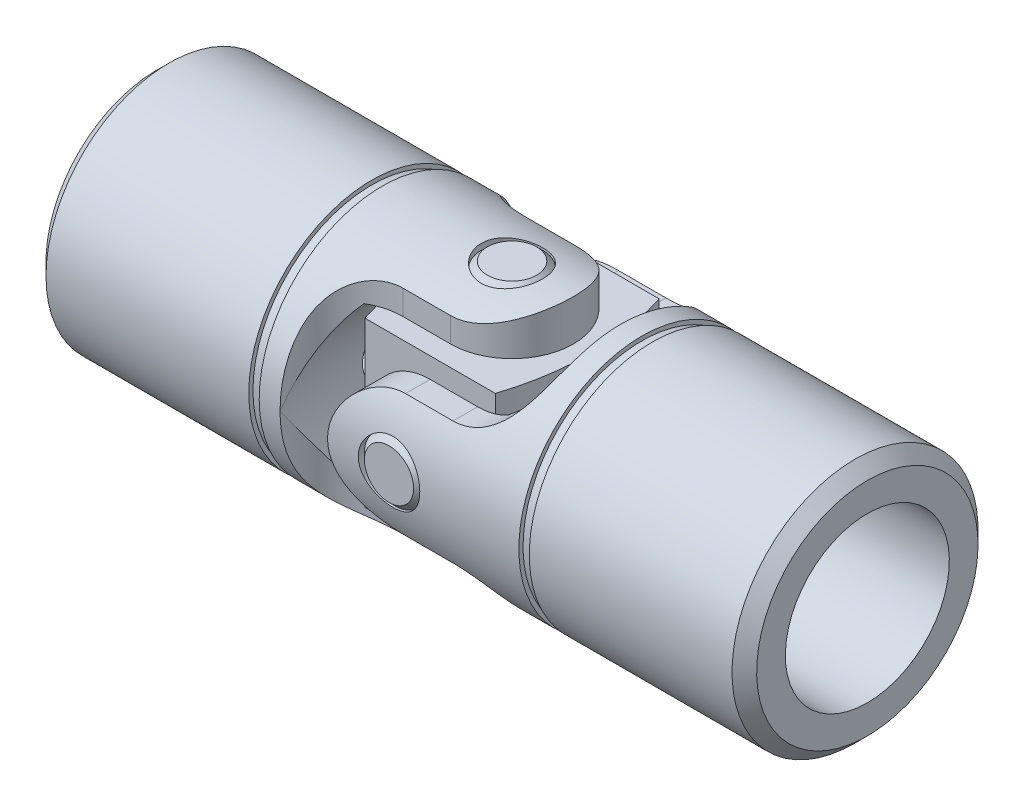
from build123d import *

# Parameters (mm, degrees)
CHAMFER1_SIZE               = 1.42875
EXTRUDE1_DEPTH              = 46.955314573
EXTRUDE1_DEPTH_BACK         = 46.955314573
EXTRUDE3_DEPTH              = 46.955314635
EXTRUDE3_DEPTH_BACK         = 46.955314635
SKETCH4_R                   = 9.525
EXTRUDE4_DEPTH              = 23.8125
EXTRUDE6_DEPTH              = 46.955314635
EXTRUDE6_DEPTH_BACK         = 46.955314635
SKETCH6_R                   = 3.571875
BODY_MOVE_COPY1_ANGLE       = 90
EXTRUDE10_REACH             = 47.955
SKETCH10_W                  = 18.176875
SKETCH10_H                  = 19.03095
EXTRUDE10_DIRECTION_2_REACH = 47.955
CUT_EXTRUDE2_DEPTH          = 50.742737236
EXTRUDE13_DEPTH             = 46.955314635
EXTRUDE13_DEPTH_BACK        = 46.955314635
SKETCH13_R                  = 3.571875
SKETCH14_R                  = 3.571875
EXTRUDE14_DEPTH             = 14.2875
EXTRUDE15_DEPTH             = 46.955314635
EXTRUDE15_DEPTH_BACK        = 46.955314635
SKETCH15_R                  = 3.571875
SKETCH16_R                  = 3.571875
EXTRUDE16_DEPTH             = 14.2875
CHAMFER3_SIZE               = 0.714375


with BuildPart() as part:
    # Sketch1 → Revolve1 (revolve)
    with BuildSketch(Plane(origin=(0, 0, 0), x_dir=(1, 0, 0), z_dir=(0, 1, 0)), mode=Mode.PRIVATE) as revolve1_sk:
        Polygon((-41.275, 14.2875), (-16.29171875, 14.2875), (-16.29171875, 13.8033125), (-15.08125, 13.8033125), (-15.08125, 14.2875), (7.14375, 14.2875), (7.14375, 0), (-41.275, 0), align=None)
    revolve(revolve1_sk.sketch.rotate(Axis((-41.275, 0, 0), (1, 0, 0)), 180), axis=Axis((-41.275, 0, 0), (1, 0, 0)))

    # Chamfer1
    chamfer1_edges = [part.edges().sort_by_distance(p)[0] for p in [
        (-41.275, 0, -14.2875),
    ]]
    chamfer(chamfer1_edges, length=CHAMFER1_SIZE)

    # Sketch2 → Extrude1 (cut, two sides: drawn at the far end of the back side and taken through both)
    with BuildSketch(Plane(origin=(0, 0, 0), x_dir=(1, 0, 0), z_dir=(0, 1, 0)).offset(-EXTRUDE1_DEPTH_BACK)):
        with BuildLine():
            Line((-12.6603125, 14.2875), (14.2875, 14.2875))
            Line((14.2875, 14.2875), (14.2875, -14.2875))
            Line((14.2875, -14.2875), (-12.6603125, -14.2875))
            ThreePointArc((-12.6603125, -14.2875), (-10.567956568, -9.236105932), (-5.5165625, -7.14375))
            Line((-5.5165625, -7.14375), (0, -7.14375))
            ThreePointArc((0, -7.14375), (7.14375, 0), (0, 7.14375))
            Line((0, 7.14375), (-5.5165625, 7.14375))
            ThreePointArc((-5.5165625, 7.14375), (-10.567956568, 9.236105932), (-12.6603125, 14.2875))
        make_face()
    extrude(amount=EXTRUDE1_DEPTH + EXTRUDE1_DEPTH_BACK, mode=Mode.SUBTRACT)

    # Sketch3 → Extrude3 (cut, two sides: drawn at the far end of the back side and taken through both)
    with BuildSketch(Plane.XY.offset(-EXTRUDE3_DEPTH_BACK)):
        with BuildLine():
            Line((-9.0884375, 9.515475), (14.2875, 9.515475))
            Line((14.2875, 9.515475), (14.2875, -9.515475))
            Line((14.2875, -9.515475), (-9.0884375, -9.515475))
            ThreePointArc((-9.0884375, -9.515475), (-12.6603125, 0), (-9.0884375, 9.515475))
        make_face()
    extrude(amount=EXTRUDE3_DEPTH + EXTRUDE3_DEPTH_BACK, mode=Mode.SUBTRACT)

    # Sketch4 → Extrude4 (cut)
    with BuildSketch(Plane.ZY.offset(41.275)):
        Circle(SKETCH4_R)
    extrude(amount=-EXTRUDE4_DEPTH, mode=Mode.SUBTRACT)

    # Extrude5 cone 1 section (through the dimple's axis) → Extrude5 (revolve, cut)
    with BuildSketch(Plane(origin=(-17.4625, 0, 0), x_dir=(0, 0, 1), z_dir=(0, 1, 0))):
        Polygon((0, 0), (9.525, 0), (0, 9.525), align=None)
    revolve(axis=Axis((-17.4625, 0, 0), (1, 0, 0)), mode=Mode.SUBTRACT)

    # Sketch6 → Extrude6 (cut, two sides: drawn at the far end of the back side and taken through both)
    with BuildSketch(Plane(origin=(0, 0, 0), x_dir=(1, 0, 0), z_dir=(0, 1, 0)).offset(-EXTRUDE6_DEPTH_BACK)):
        with Locations(Location((0, 0, 0), (0, 0, 270))):
            Circle(SKETCH6_R)
    extrude(amount=EXTRUDE6_DEPTH + EXTRUDE6_DEPTH_BACK, mode=Mode.SUBTRACT)


with BuildPart() as body_2:
    # Mirror1: mirrored copy
    add(part.part.mirror(Plane(origin=(0, 0, 0), x_dir=(0, 0, 1), z_dir=(1, 0, 0))))


with BuildPart() as body_2_1:
    # Body-Move/Copy1: moved
    add(body_2.part.rotate(Axis((0, 0, 0), (1, 0, 0)), BODY_MOVE_COPY1_ANGLE))


with BuildPart() as body_3:

    # Extrude10: up to this face of the body (flat: up to its plane)
    extrude10_end = Plane(body_2_1.part.faces().sort_by_distance((7.424859144, -7.165639968, -9.515475))[0])
    # Sketch10 → Extrude10 (new, up to the picked face)
    with BuildSketch(Plane.XY, mode=Mode.PRIVATE) as extrude10_sk1:
        Rectangle(SKETCH10_W, SKETCH10_H)
    extrude10_tool1 = split(extrude(extrude10_sk1.sketch, amount=-EXTRUDE10_REACH, mode=Mode.PRIVATE), bisect_by=extrude10_end, keep=Keep.BOTH, mode=Mode.PRIVATE)
    add(extrude10_tool1.solids().sort_by(Axis((0, 0, 0), (0, 0, -1)))[0])


    # Extrude10 direction 2: up to this face of the body (flat: up to its plane)
    extrude10_direction_2_end = Plane(body_2_1.part.faces().sort_by_distance((8.859095449, 0, 9.515475))[0])
    # Sketch10 → Extrude10 direction 2 (add, up to the picked face)
    with BuildSketch(Plane.XY, mode=Mode.PRIVATE) as extrude10_direction_2_sk1:
        Rectangle(SKETCH10_W, SKETCH10_H)
    extrude10_direction_2_tool1 = split(extrude(extrude10_direction_2_sk1.sketch, amount=EXTRUDE10_DIRECTION_2_REACH, mode=Mode.PRIVATE), bisect_by=extrude10_direction_2_end, keep=Keep.BOTH, mode=Mode.PRIVATE)
    add(extrude10_direction_2_tool1.solids().sort_by(Axis((0, 0, 0), (0, 0, 1)))[0])

    # Sketch20 → Cut-Extrude2 (cut, through all)
    with BuildSketch(Plane(origin=(0, 9.515475, 0), x_dir=(1, 0, 0), z_dir=(0, 1, 0))):
        with BuildLine():
            Line((10.1044375, -10.531475), (10.1044375, 10.531475))
            Line((10.1044375, 10.531475), (7.573697917, 10.531475))
            Line((7.573697917, 10.531475), (7.573697917, 9.515475))
            ThreePointArc((7.573697917, 9.515475), (9.0884375, 0), (7.573697917, -9.515475))
            Line((7.573697917, -9.515475), (7.573697917, -10.531475))
            Line((7.573697917, -10.531475), (10.1044375, -10.531475))
        make_face()
        with BuildLine():
            Line((-10.1044375, 10.531475), (-10.1044375, -10.531475))
            Line((-10.1044375, -10.531475), (-7.573697917, -10.531475))
            Line((-7.573697917, -10.531475), (-7.573697917, -9.515475))
            ThreePointArc((-7.573697917, -9.515475), (-9.0884375, 0), (-7.573697917, 9.515475))
            Line((-7.573697917, 9.515475), (-7.573697917, 10.531475))
            Line((-7.573697917, 10.531475), (-10.1044375, 10.531475))
        make_face()
    extrude(amount=-CUT_EXTRUDE2_DEPTH, mode=Mode.SUBTRACT)

    # Sketch13 → Extrude13 (cut, two sides: drawn at the far end of the back side and taken through both)
    with BuildSketch(Plane(origin=(0, 0, 0), x_dir=(1, 0, 0), z_dir=(0, 1, 0)).offset(-EXTRUDE13_DEPTH_BACK)):
        with Locations(Location((0, 0, 0), (0, 0, 180))):
            Circle(SKETCH13_R)
    extrude(amount=EXTRUDE13_DEPTH + EXTRUDE13_DEPTH_BACK, mode=Mode.SUBTRACT)

    # Sketch15 → Extrude15 (cut, two sides: drawn at the far end of the back side and taken through both)
    with BuildSketch(Plane.XY.offset(-EXTRUDE15_DEPTH_BACK)):
        Circle(SKETCH15_R)
    extrude(amount=EXTRUDE15_DEPTH + EXTRUDE15_DEPTH_BACK, mode=Mode.SUBTRACT)


with BuildPart() as body_4:
    # Sketch14 → Extrude14 (new, symmetric)
    with BuildSketch(Plane(origin=(0, 0, 0), x_dir=(1, 0, 0), z_dir=(0, 1, 0))):
        with Locations(Location((0, 0, 0), (0, 0, 270))):
            Circle(SKETCH14_R)
    extrude(amount=EXTRUDE14_DEPTH, both=True)

    # Sketch16 → Extrude16 (add, symmetric)
    with BuildSketch(Plane.XY):
        Circle(SKETCH16_R)
    extrude(amount=EXTRUDE16_DEPTH, both=True)

    # Chamfer3
    chamfer3_edges = [body_4.edges().sort_by_distance(p)[0] for p in [
        (0, -14.2875, -3.571875),
        (0, 14.2875, -3.571875),
        (-3.571875, 0, -14.2875),
        (-3.571875, 0, 14.2875),
    ]]
    chamfer(chamfer3_edges, length=CHAMFER3_SIZE)


solid = Compound([part.part, body_2_1.part, body_3.part, body_4.part])
